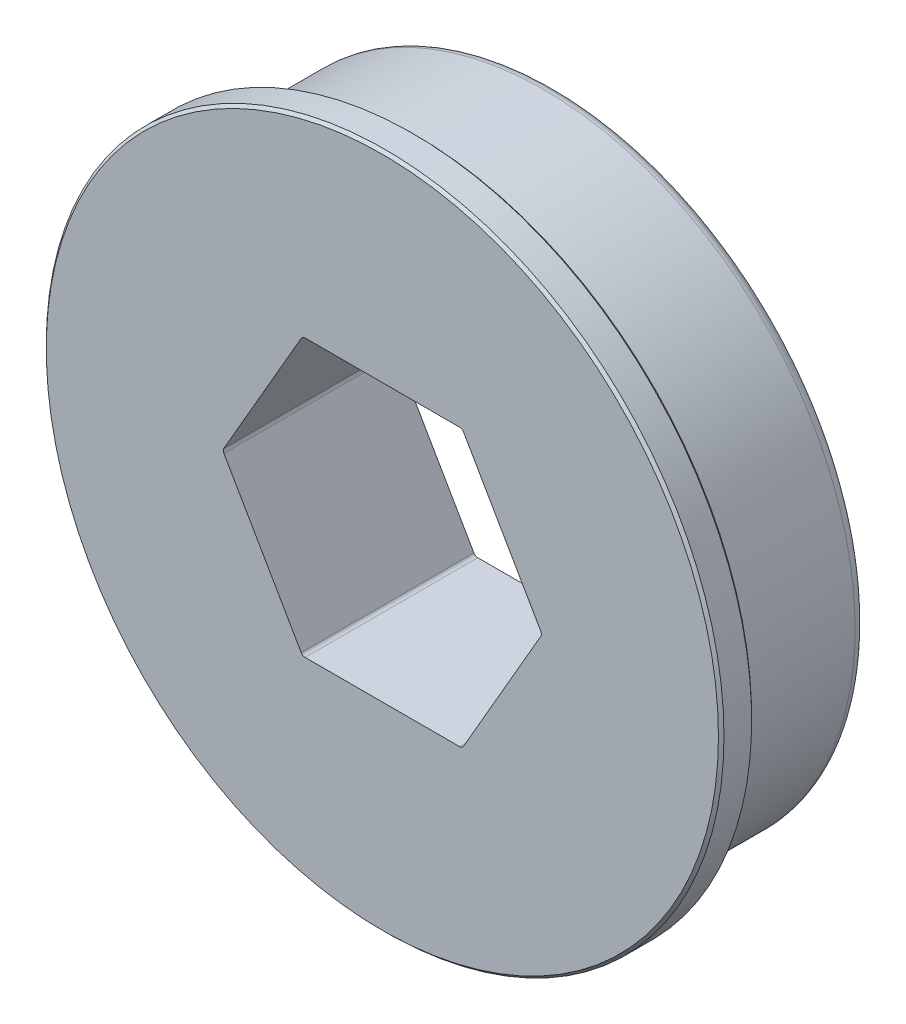
from build123d import *

# Parameters (mm, degrees)
CUT_EXTRUDE1_DEPTH = 24.386199605
CHAMFER1_SIZE      = 0.127
FILLET1_R          = 0.2032
FILLET2_R          = 0.508


with BuildPart() as part:
    # Sketch1 → Revolve1 (revolve)
    with BuildSketch(Plane.XZ, mode=Mode.PRIVATE) as revolve1_sk:
        Polygon((15.5575, 7.92734), (0, 7.92734), (0, 0), (14.2875, 0), (14.2875, 5.89534), (13.97, 5.89534), (13.97, 6.40334), (15.5575, 6.40334), align=None)
    revolve(revolve1_sk.sketch.rotate(Axis((0, 0, 7.92734), (0, 0, -1)), 180), axis=Axis((0, 0, 7.92734), (0, 0, -1)))

    # Sketch2 → Cut-Extrude1 (cut, through all)
    with BuildSketch(Plane.XY.offset(7.92734)):
        Polygon((-3.666174209, -6.35), (3.666174209, -6.35), (7.332348419, 0), (3.666174209, 6.35), (-3.666174209, 6.35), (-7.332348419, 0), align=None)
    extrude(amount=-CUT_EXTRUDE1_DEPTH, mode=Mode.SUBTRACT)

    # Chamfer1
    chamfer1_edges = [part.edges().sort_by_distance(p)[0] for p in [
        (15.5575, 0, 7.92734),
        (15.5575, 0, 6.40334),
    ]]
    chamfer(chamfer1_edges, length=CHAMFER1_SIZE)

    # Fillet1
    fillet1_edges = [part.edges().sort_by_distance(p)[0] for p in [
        (-3.666174209, -6.35, 3.96367),
        (-7.332348419, 0, 3.96367),
        (-3.666174209, 6.35, 3.96367),
        (3.666174209, 6.35, 3.96367),
        (7.332348419, 0, 3.96367),
        (3.666174209, -6.35, 3.96367),
    ]]
    fillet(fillet1_edges, radius=FILLET1_R)

    # Fillet2
    fillet2_edges = [part.edges().sort_by_distance(p)[0] for p in [
        (14.2875, 0, 0),
    ]]
    fillet(fillet2_edges, radius=FILLET2_R)


solid = part.part
